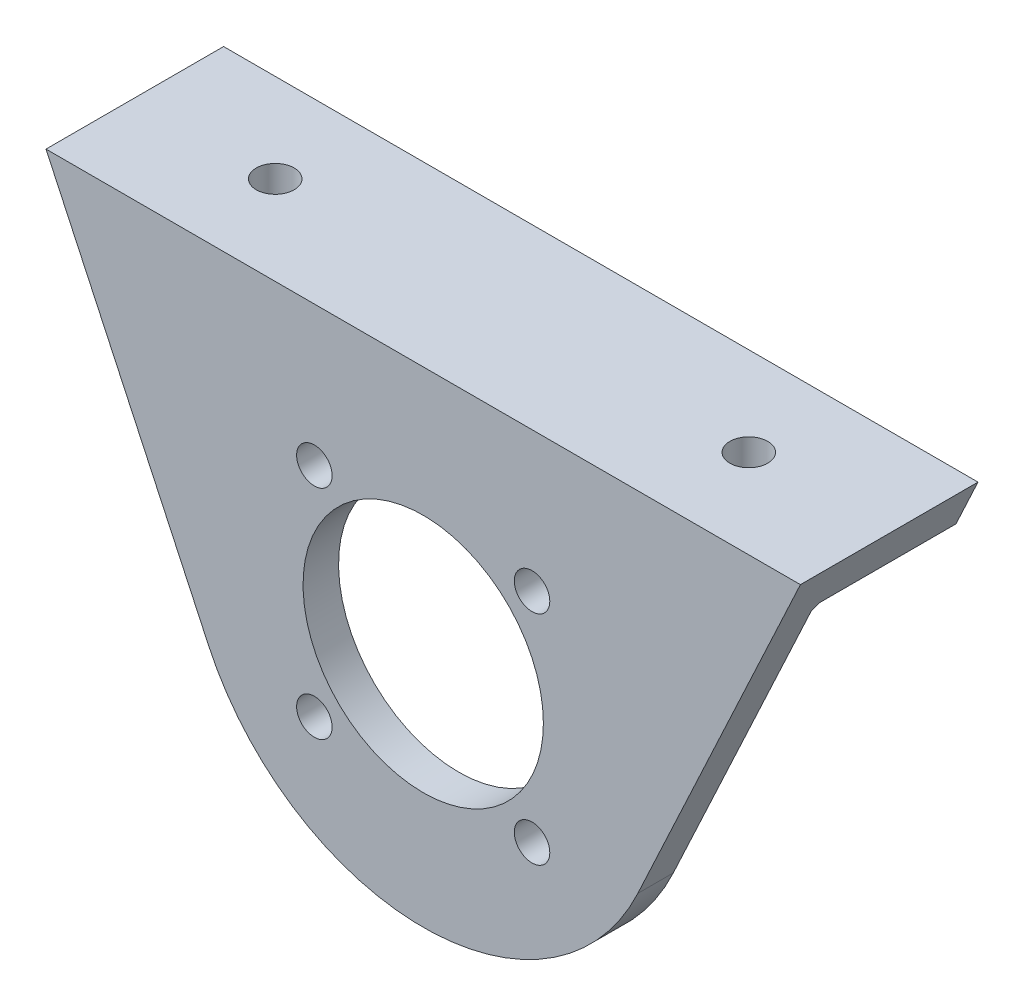
from build123d import *

# Parameters (mm, degrees)
SKETCH_1_R          = 10.15
SKETCH_1_R_2        = 1.5
EXTRUDE_1_DEPTH     = 15
SKETCH_2_W          = 12
SKETCH_2_H          = 38
CUT_EXTRUDE_1_DEPTH = 30
CHAMFER_1_SIZE      = 1.5
CUT_EXTRUDE_2_REACH = 56.047
SKETCH_3_R          = 1.6


with BuildPart() as part:
    # ｽｹｯﾁ1 → ﾎﾞｽ - 押し出し1 (new body)
    with BuildSketch(Plane.XY):
        with BuildLine():
            Line((-18.126155741, -8.452365235), (-31.860019201, 21))
            Line((-31.860019201, 21), (31.860019201, 21))
            Line((31.860019201, 21), (18.126155741, -8.452365235))
            ThreePointArc((18.126155741, -8.452365235), (0, -20), (-18.126155741, -8.452365235))
        make_face()
        Circle(SKETCH_1_R, mode=Mode.SUBTRACT)
        with Locations((-9.192388155, 9.192388155)):
            Circle(SKETCH_1_R_2, mode=Mode.SUBTRACT)
        with Locations((9.192388155, 9.192388155)):
            Circle(SKETCH_1_R_2, mode=Mode.SUBTRACT)
        with Locations((-9.192388155, -9.192388155)):
            Circle(SKETCH_1_R_2, mode=Mode.SUBTRACT)
        with Locations((9.192388155, -9.192388155)):
            Circle(SKETCH_1_R_2, mode=Mode.SUBTRACT)
    extrude(amount=EXTRUDE_1_DEPTH)

    # ｽｹｯﾁ2 → ｶｯﾄ - 押し出し1 (cut, symmetric)
    with BuildSketch(Plane(origin=(0, 0, 0), x_dir=(0, 0, -1), z_dir=(1, 0, 0))):
        with Locations((-6, -1)):
            Rectangle(SKETCH_2_W, SKETCH_2_H)
    extrude(amount=CUT_EXTRUDE_1_DEPTH, both=True, mode=Mode.SUBTRACT)

    # 面取り1
    chamfer_1_edges = [part.edges().sort_by_distance(p)[0] for p in [
        (0, 18, 12),
    ]]
    chamfer(chamfer_1_edges, length=CHAMFER_1_SIZE)

    # ｽｹｯﾁ3 → ｶｯﾄ - 押し出し2 (cut, up to next)
    with BuildSketch(Plane(origin=(0, 21, 0), x_dir=(1, 0, 0), z_dir=(0, 1, 0)), mode=Mode.PRIVATE) as cut_extrude_2_sk1:
        with Locations(Location((-20, -7.5, 0), (0, 0, 270))):
            Circle(SKETCH_3_R)
    cut_extrude_2_tool1 = extrude(cut_extrude_2_sk1.sketch, amount=-CUT_EXTRUDE_2_REACH, mode=Mode.PRIVATE) & part.part
    # ｽｹｯﾁ3 → ｶｯﾄ - 押し出し2 (cut, up to next)
    with BuildSketch(Plane(origin=(0, 21, 0), x_dir=(1, 0, 0), z_dir=(0, 1, 0)), mode=Mode.PRIVATE) as cut_extrude_2_sk2:
        with Locations(Location((20, -7.5, 0), (0, 0, 270))):
            Circle(SKETCH_3_R)
    cut_extrude_2_tool2 = extrude(cut_extrude_2_sk2.sketch, amount=-CUT_EXTRUDE_2_REACH, mode=Mode.PRIVATE) & part.part
    add(cut_extrude_2_tool1.solids().sort_by_distance((-20, 21, 7.5))[0], mode=Mode.SUBTRACT)
    add(cut_extrude_2_tool2.solids().sort_by_distance((20, 21, 7.5))[0], mode=Mode.SUBTRACT)


solid = part.part
